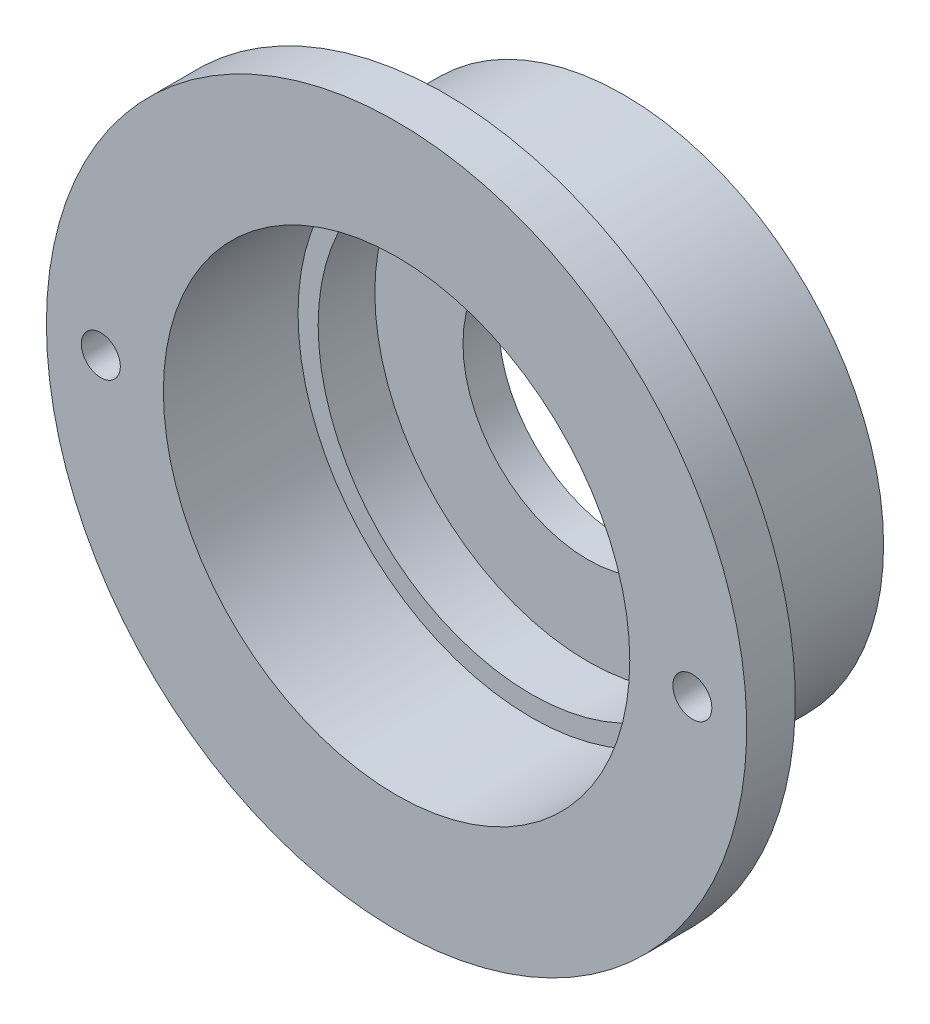
from build123d import *

# Parameters (mm, degrees)
SKETCH1_W          = 12.617819502
SKETCH1_H          = 2
SKETCH1_W_2        = 6.5532
SKETCH1_H_2        = 7.545
SKETCH2_R          = 26.652766262
SKETCH2_R_2        = 14.565
CUT_EXTRUDE1_DEPTH = 10
SKETCH4_R          = 1.0922
CUT_EXTRUDE2_DEPTH = 30.490976315


with BuildPart() as part:
    # Sketch1 → Revolve1 (revolve)
    with BuildSketch(Plane(origin=(0, 0, 0), x_dir=(1, 0, 0), z_dir=(0, 1, 0))):
        with Locations((-13.308909751, 3.700473465)):
            Rectangle(SKETCH1_W, SKETCH1_H)
        Polygon((-11.938, 2.700473465), (-19.617819502, 2.700473465), (-19.617819502, -0.474526535), (-13.064619502, -0.474526535), (-11.938, -0.474526535), align=None)
        with Locations((-16.341219502, -4.247026535)):
            Rectangle(SKETCH1_W_2, SKETCH1_H_2)
    revolve(axis=Axis((0, 0, -25.411285606), (0, 0, 1)))

    # Sketch2 → Cut-Extrude1 (cut)
    with BuildSketch(Plane(origin=(0, 0, -4.700473465), x_dir=(-1, 0, 0), z_dir=(0, 0, -1))):
        Circle(SKETCH2_R)
        Circle(SKETCH2_R_2, mode=Mode.SUBTRACT)
    extrude(amount=-CUT_EXTRUDE1_DEPTH, mode=Mode.SUBTRACT)

    # Sketch4 → Cut-Extrude2 (cut, through all)
    with BuildSketch(Plane(origin=(0, 0, 5.299526535), x_dir=(-1, 0, 0), z_dir=(0, 0, -1))):
        with Locations((16.57, 0)):
            Circle(SKETCH4_R)
        with Locations(Location((-16.57, 0, 0), (0, 0, 180))):
            Circle(SKETCH4_R)
    extrude(amount=-CUT_EXTRUDE2_DEPTH, mode=Mode.SUBTRACT)


solid = part.part
